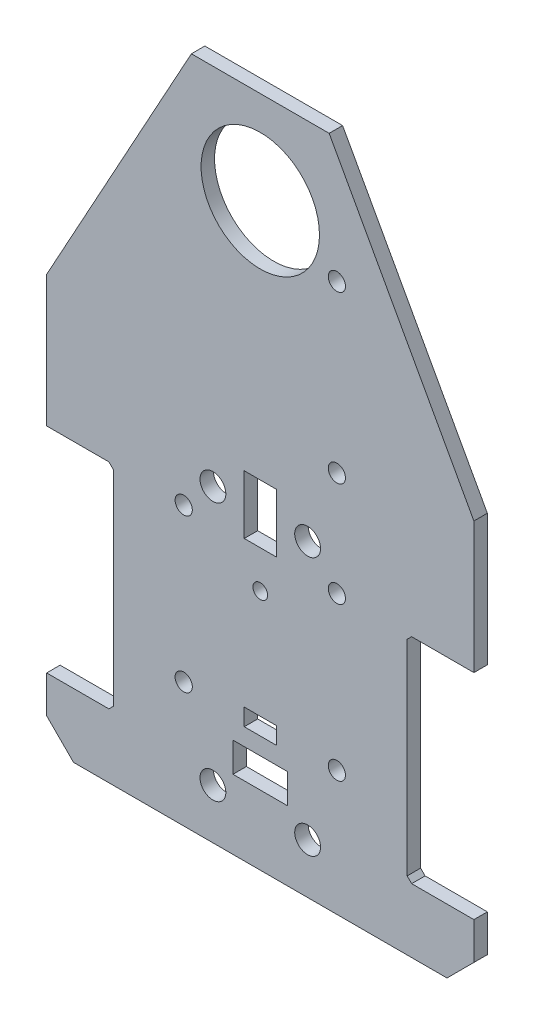
from build123d import *

# Parameters (mm, degrees)
ESQUISSE1_R        = 13.2
ESQUISSE1_R_2      = 1.92
ESQUISSE1_R_3      = 2.88
ESQUISSE1_R_4      = 1.63358903
ESQUISSE1_W        = 7.152
ESQUISSE1_H        = 3.804
ESQUISSE1_W_2      = 7.15
ESQUISSE1_H_2      = 13.08
ESQUISSE1_W_3      = 12.18
ESQUISSE1_H_3      = 6.6
BOSS_EXTRU_1_DEPTH = 3


with BuildPart() as part:
    # Esquisse1 → Boss.-Extru.1 (new body)
    with BuildSketch(Plane.XY):
        Polygon((-15.36, 61.550503597), (15.36, 61.550503597), (47.64, 2.810503597), (47.64, -26.469496403), (33.76, -26.469496403), (32.76, -27.469496403), (32.76, -73.169496403), (33.76, -74.169496403), (47.64, -74.169496403), (47.64, -82.449496403), (41.64, -88.449496403), (-41.64, -88.449496403), (-47.64, -82.449496403), (-47.64, -74.169496403), (-33.76, -74.169496403), (-32.76, -73.169496403), (-32.76, -27.469496403), (-33.76, -26.469496403), (-47.64, -26.469496403), (-47.64, 2.810503597), align=None)
        with Locations((0, 40.850503597)):
            Circle(ESQUISSE1_R, mode=Mode.SUBTRACT)
        with Locations((17.076, -26.469496403)):
            Circle(ESQUISSE1_R_2, mode=Mode.SUBTRACT)
        with Locations((17.076, -60.621496403)):
            Circle(ESQUISSE1_R_2, mode=Mode.SUBTRACT)
        with Locations((10.56, -77.301496403)):
            Circle(ESQUISSE1_R_3, mode=Mode.SUBTRACT)
        with Locations((-10.56, -77.301496403)):
            Circle(ESQUISSE1_R_3, mode=Mode.SUBTRACT)
        with Locations((-17.076, -60.621496403)):
            Circle(ESQUISSE1_R_2, mode=Mode.SUBTRACT)
        with Locations((-17.076, -26.469496403)):
            Circle(ESQUISSE1_R_2, mode=Mode.SUBTRACT)
        with Locations((17.076, 33.802499019)):
            Circle(ESQUISSE1_R_2, mode=Mode.SUBTRACT)
        with Locations((17.076, -3.201200519)):
            Circle(ESQUISSE1_R_2, mode=Mode.SUBTRACT)
        with Locations((0, -34.547074796)):
            Circle(ESQUISSE1_R_4, mode=Mode.SUBTRACT)
        with Locations((10.56, -19.626900252)):
            Circle(ESQUISSE1_R_3, mode=Mode.SUBTRACT)
        with Locations((-10.56, -19.626900252)):
            Circle(ESQUISSE1_R_3, mode=Mode.SUBTRACT)
        with Locations((0, -60.627496403)):
            Rectangle(ESQUISSE1_W, ESQUISSE1_H, mode=Mode.SUBTRACT)
        with Locations((0, -19.629496403)):
            Rectangle(ESQUISSE1_W_2, ESQUISSE1_H_2, mode=Mode.SUBTRACT)
        with Locations((0, -69.669496403)):
            Rectangle(ESQUISSE1_W_3, ESQUISSE1_H_3, mode=Mode.SUBTRACT)
    extrude(amount=BOSS_EXTRU_1_DEPTH)


solid = part.part
